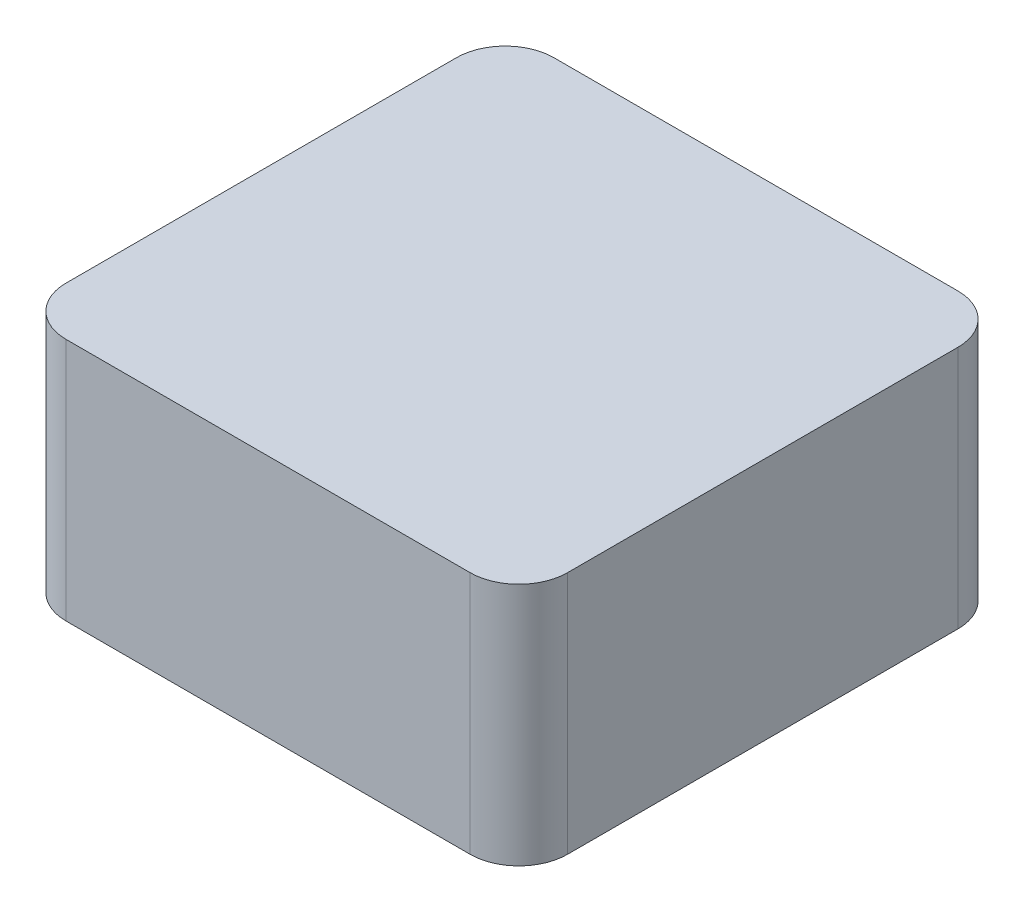
from build123d import *

# Parameters (mm, degrees)
SKETCH1_W           = 13.0556
SKETCH1_H           = 12.7
BOSS_EXTRUDE1_DEPTH = 6.35
FILLET1_R           = 1.27


with BuildPart() as part:
    # Sketch1 → Boss-Extrude1 (new body)
    with BuildSketch(Plane(origin=(0, 0, 0), x_dir=(1, 0, 0), z_dir=(0, 1, 0))):
        Rectangle(SKETCH1_W, SKETCH1_H)
    extrude(amount=BOSS_EXTRUDE1_DEPTH)

    # Fillet1
    fillet1_edges = [part.edges().sort_by_distance(p)[0] for p in [
        (-6.5278, 3.175, -6.35),
        (6.5278, 3.175, -6.35),
        (6.5278, 3.175, 6.35),
        (-6.5278, 3.175, 6.35),
    ]]
    fillet(fillet1_edges, radius=FILLET1_R)


solid = part.part
